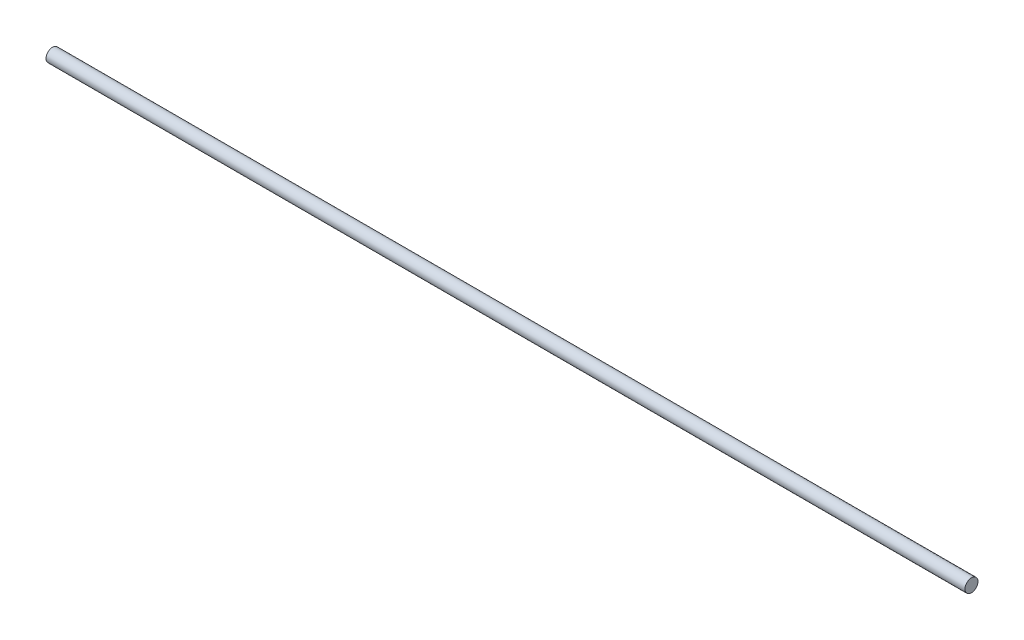
from build123d import *

# Parameters (mm, degrees)
SKETCH_1_W = 352
SKETCH_1_H = 2.5


with BuildPart() as part:
    # 草图1 → 旋转1 (revolve)
    with BuildSketch(Plane.XY.offset(-33.499999999), mode=Mode.PRIVATE) as revolve_1_sk:
        with Locations((0, 332.828947368)):
            Rectangle(SKETCH_1_W, SKETCH_1_H)
    revolve(revolve_1_sk.sketch.rotate(Axis((-176, 331.578947368, -33.499999999), (1, 0, 0)), 270), axis=Axis((-176, 331.578947368, -33.499999999), (1, 0, 0)))


solid = part.part
